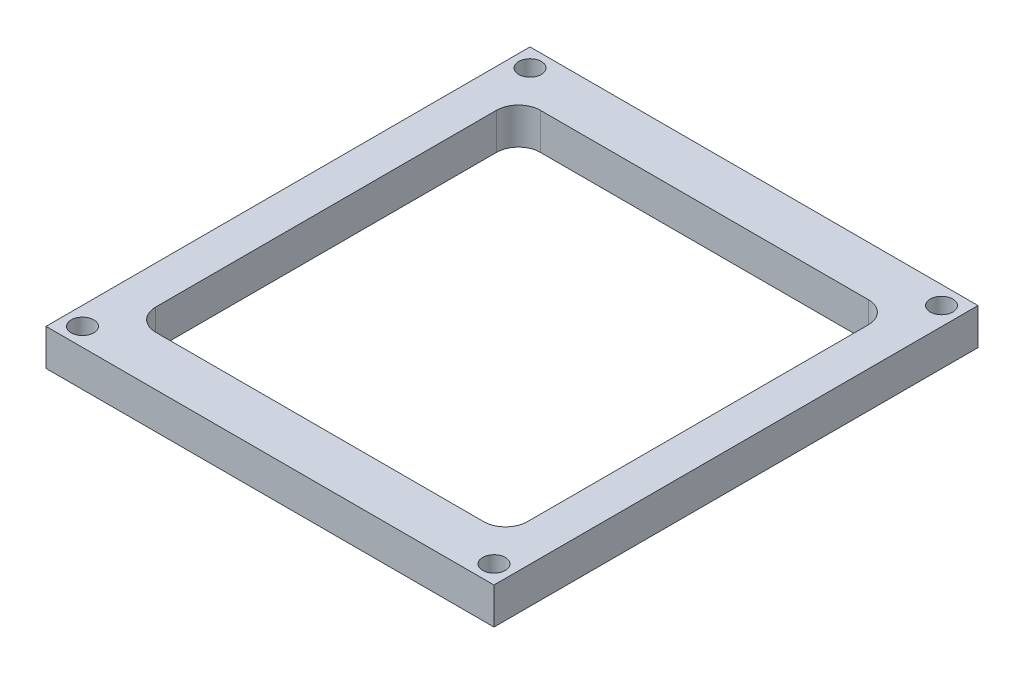
from build123d import *

# Parameters (mm, degrees)
SKETCH1_W           = 61.4
SKETCH1_H           = 66.34
SKETCH1_R           = 1.55
BOSS_EXTRUDE1_DEPTH = 5


with BuildPart() as part:
    # Sketch1 → Boss-Extrude1 (new body)
    with BuildSketch(Plane(origin=(0, 0, 0), x_dir=(1, 0, 0), z_dir=(0, 1, 0))):
        with Locations((9.719215892, -3.98392863)):
            Rectangle(SKETCH1_W, SKETCH1_H)
        with Locations(Location((-18.480784108, 26.68607137, 0), (0, 0, 270))):
            Circle(SKETCH1_R, mode=Mode.SUBTRACT)
        with Locations(Location((37.919215892, 26.68607137, 0), (0, 0, 90))):
            Circle(SKETCH1_R, mode=Mode.SUBTRACT)
        with Locations(Location((37.919215892, -34.65392863, 0), (0, 0, 270))):
            Circle(SKETCH1_R, mode=Mode.SUBTRACT)
        with Locations(Location((-18.480784108, -34.65392863, 0), (0, 0, 90))):
            Circle(SKETCH1_R, mode=Mode.SUBTRACT)
        with BuildLine():
            Line((-12.755784108, -30.33892863), (32.194215892, -30.33892863))
            ThreePointArc((32.194215892, -30.33892863), (34.315536235, -29.460248974), (35.194215892, -27.33892863))
            Line((35.194215892, -27.33892863), (35.194215892, 19.37107137))
            ThreePointArc((35.194215892, 19.37107137), (34.315536235, 21.492391714), (32.194215892, 22.37107137))
            Line((32.194215892, 22.37107137), (-12.755784108, 22.37107137))
            ThreePointArc((-12.755784108, 22.37107137), (-14.877104452, 21.492391714), (-15.755784108, 19.37107137))
            Line((-15.755784108, 19.37107137), (-15.755784108, -27.33892863))
            ThreePointArc((-15.755784108, -27.33892863), (-14.877104452, -29.460248974), (-12.755784108, -30.33892863))
        make_face(mode=Mode.SUBTRACT)
    extrude(amount=BOSS_EXTRUDE1_DEPTH)


solid = part.part
